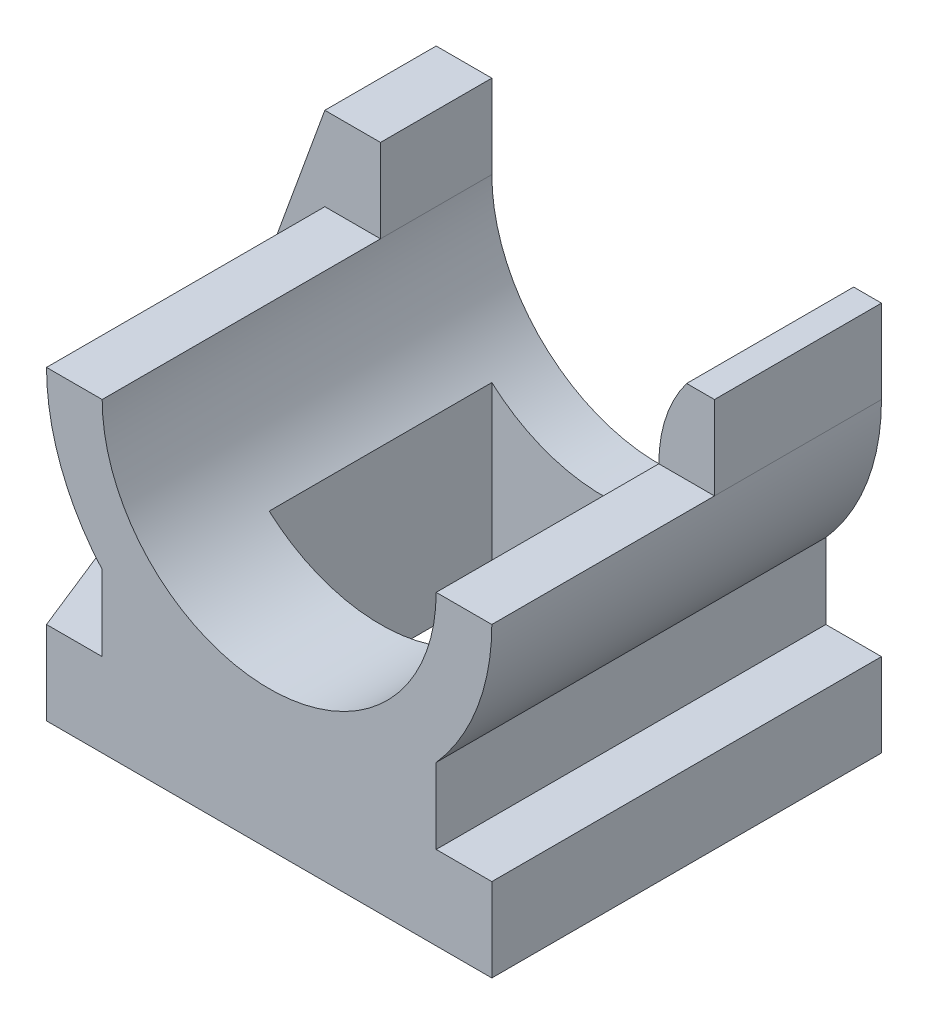
from build123d import *

# Parameters (mm, degrees)
BOSS_EXTRUDE1_DEPTH = 15
BOSS_EXTRUDE2_DEPTH = 70
BOSS_EXTRUDE3_DEPTH = 20
BOSS_EXTRUDE4_DEPTH = 30
CUT_EXTRUDE1_DEPTH  = 116.758369028
SKETCH6_W           = 40
SKETCH6_H           = 40
CUT_EXTRUDE2_DEPTH  = 116.758369028


with BuildPart() as part:
    # Sketch1 → Boss-Extrude1 (new body)
    with BuildSketch(Plane(origin=(0, 0, 0), x_dir=(1, 0, 0), z_dir=(0, 1, 0))):
        Polygon((-60, 0), (40, 0), (40, -70), (-40, -70), (-60, -20), align=None)
    extrude(amount=BOSS_EXTRUDE1_DEPTH)

    # Sketch2 → Boss-Extrude2 (add)
    with BuildSketch(Plane.XY):
        with BuildLine():
            Line((-30, 10), (30, 10))
            Line((30, 10), (30, 28.542486889))
            ThreePointArc((30, 28.542486889), (37.416573868, 40.857864376), (40, 55))
            Line((40, 55), (-40, 55))
            ThreePointArc((-40, 55), (-37.416573868, 40.857864376), (-30, 28.542486889))
            Line((-30, 28.542486889), (-30, 10))
        make_face()
    extrude(amount=BOSS_EXTRUDE2_DEPTH)

    # Sketch3 → Boss-Extrude3 (add)
    with BuildSketch(Plane.XY):
        Polygon((-60, 15), (-30, 15), (-30, 70), (-40, 70), align=None)
    extrude(amount=BOSS_EXTRUDE3_DEPTH)

    # Sketch4 → Boss-Extrude4 (add)
    with BuildSketch(Plane.XY):
        with BuildLine():
            Line((30, 55), (40, 55))
            Line((40, 55), (40, 70))
            Line((40, 70), (35, 70))
            ThreePointArc((35, 70), (31.282917549, 62.90569415), (30, 55))
        make_face()
    extrude(amount=BOSS_EXTRUDE4_DEPTH)

    # Sketch5 → Cut-Extrude1 (cut, through all)
    with BuildSketch(Plane.XY):
        with BuildLine():
            Line((-30, 55), (30, 55))
            ThreePointArc((30, 55), (0, 25), (-30, 55))
        make_face()
    extrude(amount=CUT_EXTRUDE1_DEPTH, mode=Mode.SUBTRACT)

    # Sketch6 → Cut-Extrude2 (cut, through all)
    with BuildSketch(Plane(origin=(0, 0, 0), x_dir=(1, 0, 0), z_dir=(0, 1, 0))):
        with Locations((0, -30)):
            Rectangle(SKETCH6_W, SKETCH6_H)
    extrude(amount=CUT_EXTRUDE2_DEPTH, mode=Mode.SUBTRACT)


solid = part.part
